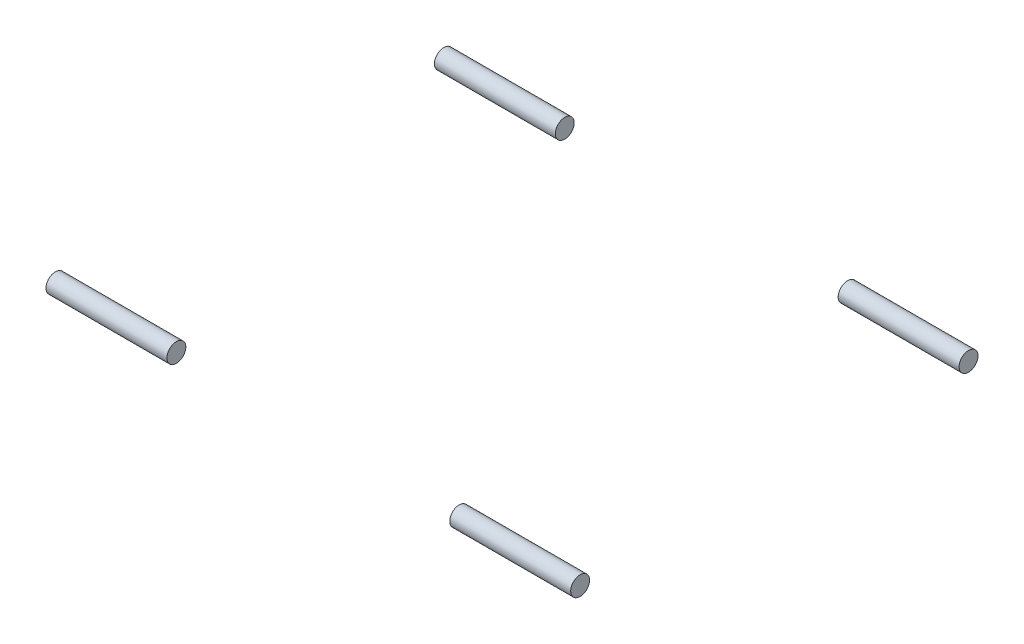
from build123d import *

# Parameters (mm, degrees)
SKETCH1_R             = 3.175
BOSS_EXTRUDE1_DEPTH   = 40.640000048
BOSS_EXTRUDE1_2_DEPTH = 40.640000048


with BuildPart() as part:
    # Sketch1 → Boss-Extrude1 (new body)
    with BuildSketch(Plane.ZY.offset(-88.15)):
        with Locations(Location((130.499998656, 0, 0), (0, 0, 180))):
            Circle(SKETCH1_R)
    extrude(amount=BOSS_EXTRUDE1_DEPTH)


with BuildPart() as body_2:
    # Sketch1 → Boss-Extrude1 2 (new body)
    with BuildSketch(Plane.ZY.offset(-88.15)):
        with Locations(Location((0, 0, 0), (0, 0, 180))):
            Circle(SKETCH1_R)
    extrude(amount=BOSS_EXTRUDE1_2_DEPTH)


with BuildPart() as body_3:
    # Mirror1: mirrored copy
    add(part.part.mirror(Plane(origin=(0, 0, 0), x_dir=(0, 0, 1), z_dir=(1, 0, 0))))


with BuildPart() as body_4:
    # Mirror1 2: mirrored copy
    add(body_2.part.mirror(Plane(origin=(0, 0, 0), x_dir=(0, 0, 1), z_dir=(1, 0, 0))))


solid = Compound([part.part, body_2.part, body_3.part, body_4.part])
